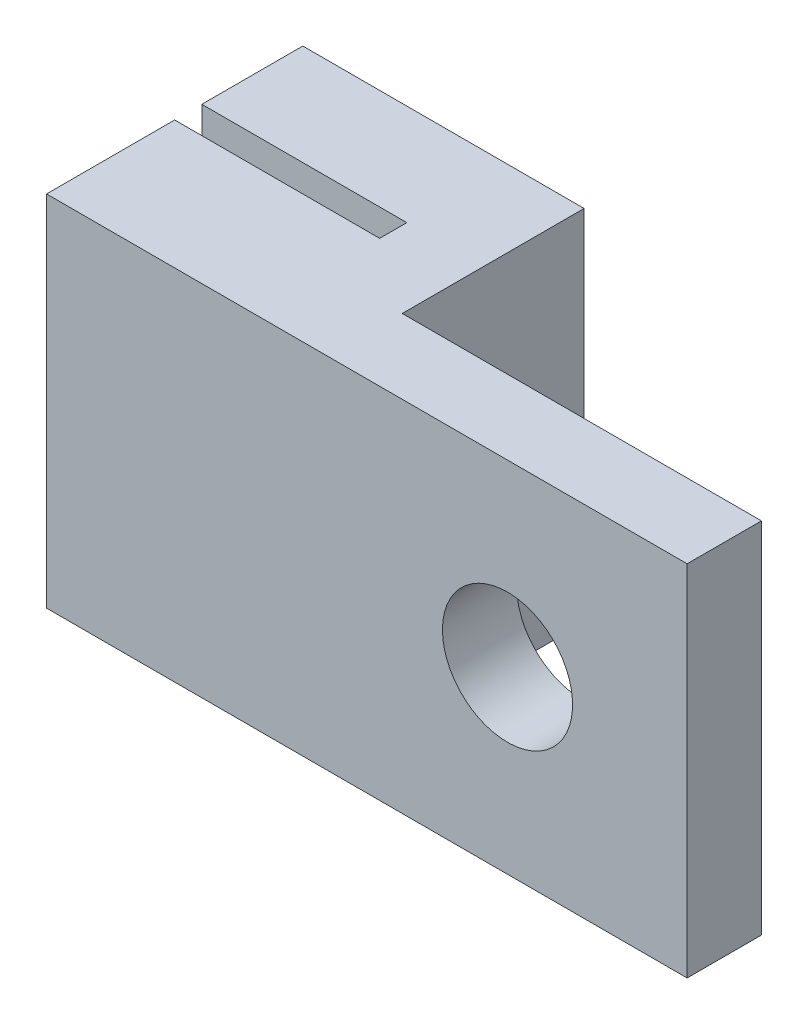
from build123d import *

# Parameters (mm, degrees)
BOSS_EXTRUDE1_DEPTH = 14
SKETCH2_W           = 14.019698715
SKETCH2_H           = 7.099583751
CUT_EXTRUDE1_DEPTH  = 1301.121764584
SKETCH4_R           = 2.54
CUT_EXTRUDE2_DEPTH  = 1238.809657762


with BuildPart() as part:
    # Sketch1 → Boss-Extrude1 (new body)
    with BuildSketch(Plane(origin=(0, 0, 0), x_dir=(1, 0, 0), z_dir=(0, 1, 0))):
        Polygon((-1237.710121457, -392.736417727), (-1237.710121457, -397.736417727), (-1212.710121457, -397.736417727), (-1212.710121457, -387.736417727), (-1237.710121457, -387.736417727), (-1237.710121457, -391.676417727), (-1229.710121457, -391.676417727), (-1229.710121457, -392.736417727), align=None)
    extrude(amount=-BOSS_EXTRUDE1_DEPTH)

    # Sketch2 → Cut-Extrude1 (cut, through all)
    with BuildSketch(Plane(origin=(0, 0, 0), x_dir=(1, 0, 0), z_dir=(0, 1, 0))):
        with Locations((-1219.719970814, -391.286209602)):
            Rectangle(SKETCH2_W, SKETCH2_H)
    extrude(amount=-CUT_EXTRUDE1_DEPTH, mode=Mode.SUBTRACT)

    # Sketch4 → Cut-Extrude2 (cut, through all)
    with BuildSketch(Plane(origin=(0, 0, 394.836001478), x_dir=(-1, 0, 0), z_dir=(0, 0, -1))):
        with Locations((1219.719970815, -7)):
            Circle(SKETCH4_R)
    extrude(amount=-CUT_EXTRUDE2_DEPTH, mode=Mode.SUBTRACT)


solid = part.part
